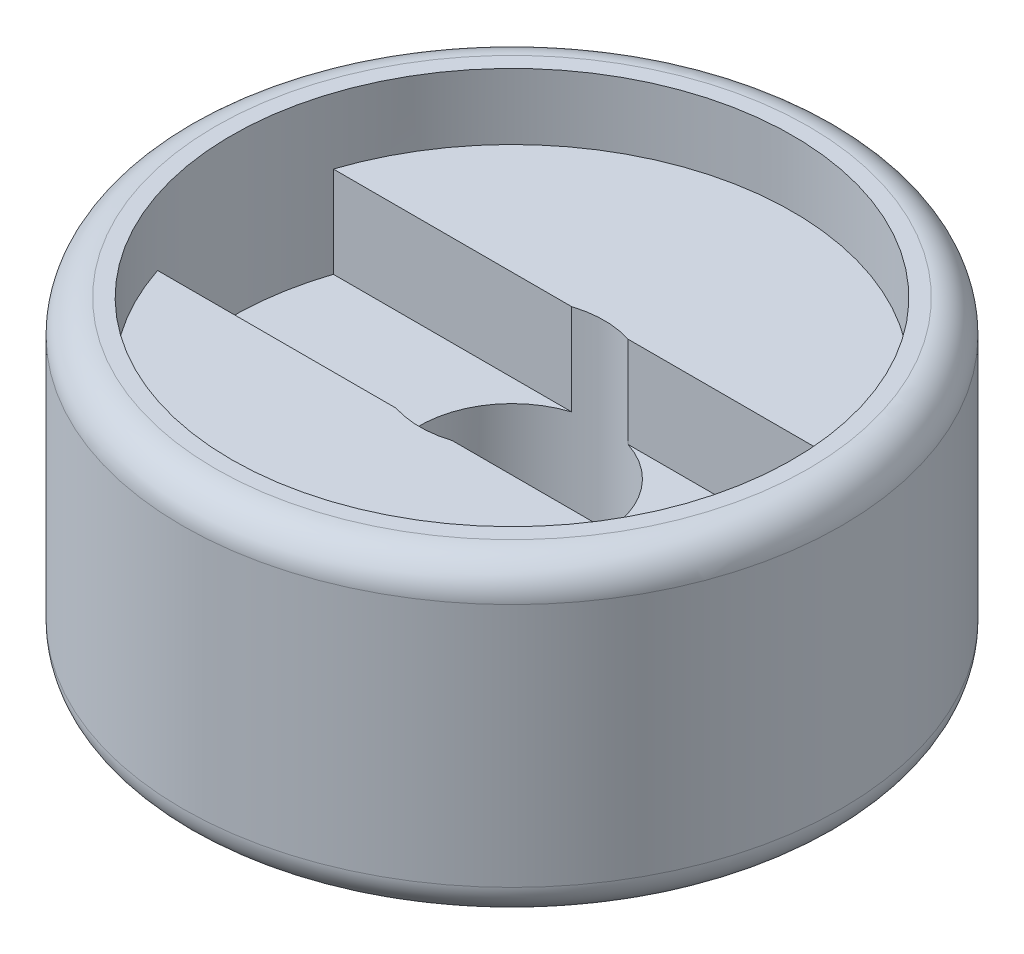
from build123d import *
from build123d.topology import SkipClean

# Parameters (mm, degrees)
SKETCH1_R                       = 15
BOSS_EXTRUDE1_DEPTH             = 7
SKETCH2_R                       = 4.2
CUT_EXTRUDE1_DEPTH              = 7
BOSS_EXTRUDE2_DEPTH             = 4.15
SKETCH1_5_R                     = 2.1
CUT_EXTRUDE2_DEPTH              = 6.5
SKETCH6_R                       = 15
SKETCH6_R_2                     = 12.775
BOSS_EXTRUDE3_DEPTH             = 3
BOSS_EXTRUDE3_DIRECTION_2_REACH = 25.965
FILLET1_R                       = 1.5


with BuildPart() as part:
    # Sketch1 → Boss-Extrude1 (new body)
    with BuildSketch(Plane(origin=(0, 0, 0), x_dir=(1, 0, 0), z_dir=(0, 1, 0))):
        with Locations(Location((0, 0, 0), (0, 0, 270))):
            Circle(SKETCH1_R)
    extrude(amount=BOSS_EXTRUDE1_DEPTH)

    # Sketch2 → Cut-Extrude1 (cut)
    with BuildSketch(Plane(origin=(0, 0, 0), x_dir=(1, 0, 0), z_dir=(0, 1, 0))):
        with Locations(Location((0, 0, 0), (0, 0, 270))):
            Circle(SKETCH2_R)
    extrude(amount=CUT_EXTRUDE1_DEPTH, mode=Mode.SUBTRACT)

    # Sketch5 → Boss-Extrude2 (add)
    with SkipClean():  # the faces are left unmerged after this step: merging them gives an invalid solid
        with BuildSketch(Plane(origin=(0, 7, 0), x_dir=(1, 0, 0), z_dir=(0, 1, 0))):
            with BuildLine():
                ThreePointArc((14.456832, 4), (0, 15), (-14.456832, 4))
                Line((-14.456832, 4), (-1.280625, 4))
                ThreePointArc((-1.280625, 4), (0, 4.2), (1.280625, 4))
                Line((1.280625, 4), (14.456832, 4))
            make_face()
            with BuildLine():
                Line((-1.280625, -4), (-14.456832, -4))
                ThreePointArc((-14.456832, -4), (0, -15), (14.456832, -4))
                Line((14.456832, -4), (1.280625, -4))
                ThreePointArc((1.280625, -4), (0, -4.2), (-1.280625, -4))
            make_face()
        extrude(amount=BOSS_EXTRUDE2_DEPTH)

    # Sketch1<5> → Cut-Extrude2 (cut)
    with SkipClean():  # the faces are left unmerged after this step: merging them gives an invalid solid
        with BuildSketch(Plane(origin=(0, 0, 0), x_dir=(1, 0, 0), z_dir=(0, 1, 0))):
            with Locations(Location((0, -9.5, 0), (0, 0, 90))):
                Circle(SKETCH1_5_R)
            with Locations(Location((-8.227241, 4.75, 0), (0, 0, 90))):
                Circle(SKETCH1_5_R)
            with Locations(Location((8.227241, 4.75, 0), (0, 0, 90))):
                Circle(SKETCH1_5_R)
        extrude(amount=CUT_EXTRUDE2_DEPTH, mode=Mode.SUBTRACT)

    # Sketch6 → Boss-Extrude3 (add)
    with SkipClean():  # the faces are left unmerged after this step: merging them gives an invalid solid
        with BuildSketch(Plane(origin=(0, 11.15, 0), x_dir=(1, 0, 0), z_dir=(0, 1, 0))):
            with Locations(Location((0, 0, 0), (0, 0, 270))):
                Circle(SKETCH6_R)
            with Locations(Location((0, 0, 0), (0, 0, 270))):
                Circle(SKETCH6_R_2, mode=Mode.SUBTRACT)
        extrude(amount=BOSS_EXTRUDE3_DEPTH)

    # Boss-Extrude3 direction 2: up to this face of the body (flat: up to its plane)
    boss_extrude3_direction_2_end = Plane(part.part.faces().sort_by_distance((-9.095084, 7, 0))[0])
    # Sketch6 → Boss-Extrude3 direction 2 (add, up to the picked face)
    with BuildSketch(Plane(origin=(0, 11.15, 0), x_dir=(1, 0, 0), z_dir=(0, 1, 0)), mode=Mode.PRIVATE) as boss_extrude3_direction_2_sk1:
        with Locations(Location((0, 0, 0), (0, 0, 270))):
            Circle(SKETCH6_R)
        with Locations(Location((0, 0, 0), (0, 0, 270))):
            Circle(SKETCH6_R_2, mode=Mode.SUBTRACT)
    boss_extrude3_direction_2_tool1 = split(extrude(boss_extrude3_direction_2_sk1.sketch, amount=-BOSS_EXTRUDE3_DIRECTION_2_REACH, mode=Mode.PRIVATE), bisect_by=boss_extrude3_direction_2_end, keep=Keep.BOTH, mode=Mode.PRIVATE)
    add(boss_extrude3_direction_2_tool1.solids().sort_by(Axis((0, 11.15, -14.575736), (0, -1, 0)))[0])

    # Fillet1
    fillet1_edges = [part.edges().sort_by_distance(p)[0] for p in [
        (0, 0, -15),
        (0, 14.15, -15),
    ]]
    fillet(fillet1_edges, radius=FILLET1_R)


solid = part.part
